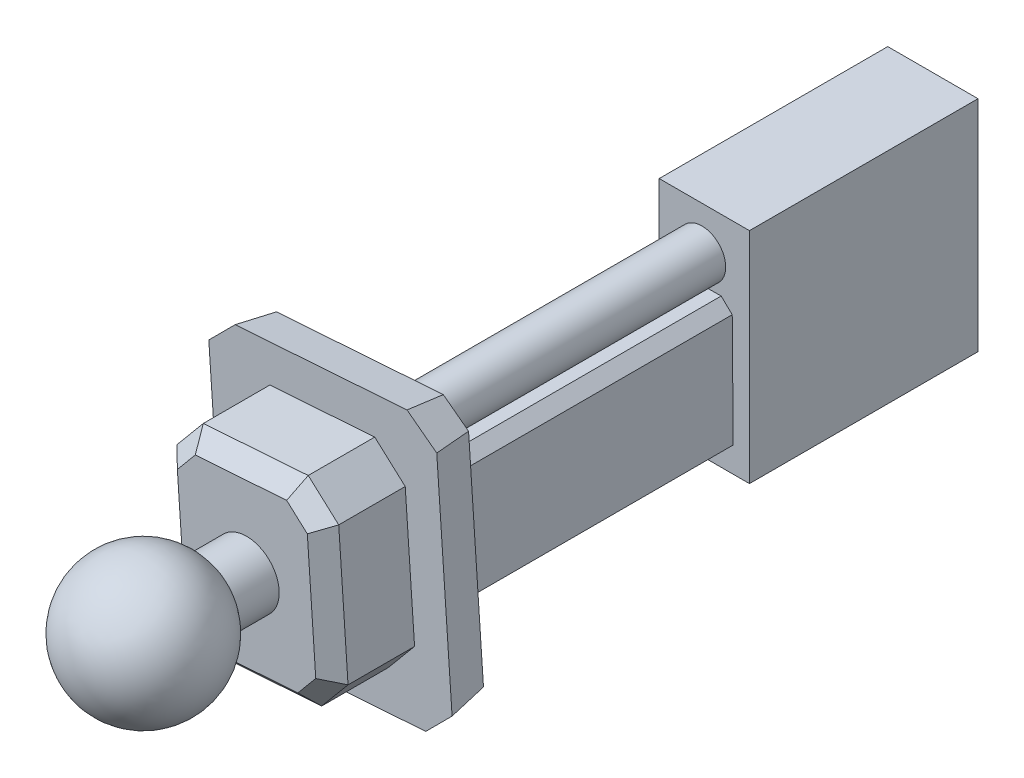
from build123d import *

# Parameters (mm, degrees)
SKETCH1_W           = 24.092408
SKETCH1_H           = 58.498994
BOSS_EXTRUDE1_DEPTH = 61.016388
SKETCH2_R           = 6.346800124
BOSS_EXTRUDE2_DEPTH = 83.73364
BOSS_EXTRUDE3_DEPTH = 10.235946
BOSS_EXTRUDE3_DRAFT = -10
BOSS_EXTRUDE4_DEPTH = 22.011894
CHAMFER1_SIZE       = 4.256024


with BuildPart() as part:
    # Sketch1 → Boss-Extrude1 (new body)
    with BuildSketch(Plane.XY):
        with Locations((129.44221, 281.648027)):
            Rectangle(SKETCH1_W, SKETCH1_H)
    extrude(amount=BOSS_EXTRUDE1_DEPTH)

    # Sketch2 → Boss-Extrude2 (add)
    with BuildSketch(Plane.XY.offset(61.016388)):
        with Locations((128.797304, 299.288048124)):
            Circle(SKETCH2_R)
        Polygon((118.62689, 289.014154), (121.536714, 291.906706), (133.935216, 292.005766), (136.89203, 289.161982), (137.15365, 259.165852), (134.240778, 256.272792), (121.831608, 256.171192), (118.88851, 259.018278), align=None)
    extrude(amount=BOSS_EXTRUDE2_DEPTH)


with BuildPart() as boss_extrude3_tool:
    # Sketch3 → Boss-Extrude3 (with draft: the straight prism first)
    with BuildSketch(Plane.XY.offset(144.750028)):
        Polygon((92.973398, 306.72786), (96.953832, 249.578876), (103.696262, 244.488716), (148.240242, 247.626124), (154.211274, 253.612142), (150.230586, 310.760872), (143.488156, 315.851286), (98.94443, 312.713624), align=None)
    extrude(amount=BOSS_EXTRUDE3_DEPTH)
    # Boss-Extrude3: the draft: its side faces are tilted about the plane it starts from
    boss_extrude3_sides = [boss_extrude3_tool.faces().sort_by_distance(p)[0] for p in [
        (94.963615, 278.153368, 149.868001),
        (100.325047, 247.033796, 149.868001),
        (125.968252, 246.05742, 149.868001),
        (151.225758, 250.619133, 149.868001),
        (152.22093, 282.186507, 149.868001),
        (146.859371, 313.306079, 149.868001),
        (121.216293, 314.282455, 149.868001),
        (95.958914, 309.720742, 149.868001),
    ]]
    draft(boss_extrude3_sides, Plane.XY.offset(144.750028), BOSS_EXTRUDE3_DRAFT)


with BuildPart() as part_1:
    add(part.part)

    # Boss-Extrude3: add boss_extrude3_tool
    add(boss_extrude3_tool.part)

    # Sketch4 → Boss-Extrude4 (add)
    with BuildSketch(Plane.XY.offset(154.985974)):
        Polygon((100.368862, 296.721784), (107.41025, 305.1429), (135.417814, 307.115718), (143.557752, 299.763942), (146.04746, 264.019538), (139.006072, 255.598422), (110.998508, 253.625604), (102.858316, 260.97738), align=None)
    extrude(amount=BOSS_EXTRUDE4_DEPTH)

    # Chamfer1
    chamfer1_edges = [part_1.edges().sort_by_distance(p)[0] for p in [
        (101.613589, 278.849582, 176.997868),
        (106.928412, 257.301492, 176.997868),
        (125.00229, 254.612013, 176.997868),
        (142.526766, 259.80898, 176.997868),
        (144.802606, 281.89174, 176.997868),
        (139.487783, 303.43983, 176.997868),
        (121.414032, 306.129309, 176.997868),
        (103.889556, 300.932342, 176.997868),
    ]]
    chamfer(chamfer1_edges, length=CHAMFER1_SIZE)

    # Sketch6 → Revolve1 (revolve)
    with BuildSketch(Plane(origin=(123.208151271, 0, 0), x_dir=(0, 0, -1), z_dir=(1, 0, 0)), mode=Mode.PRIVATE) as revolve1_sk:
        with BuildLine():
            Line((-176.997868, 280.370660315), (-176.997868, 289.089464315))
            Line((-176.997868, 289.089464315), (-188.349382, 289.089464315))
            ThreePointArc((-188.349382, 289.089464315), (-209.048874501, 298.213625605), (-222.953834, 280.370660315))
            Line((-222.953834, 280.370660315), (-176.997868, 280.370660315))
        make_face()
    revolve(revolve1_sk.sketch.rotate(Axis((123.208151271, 280.370660315, 176.997868), (0, 0, 1)), 90), axis=Axis((123.208151271, 280.370660315, 176.997868), (0, 0, 1)))


solid = part_1.part
